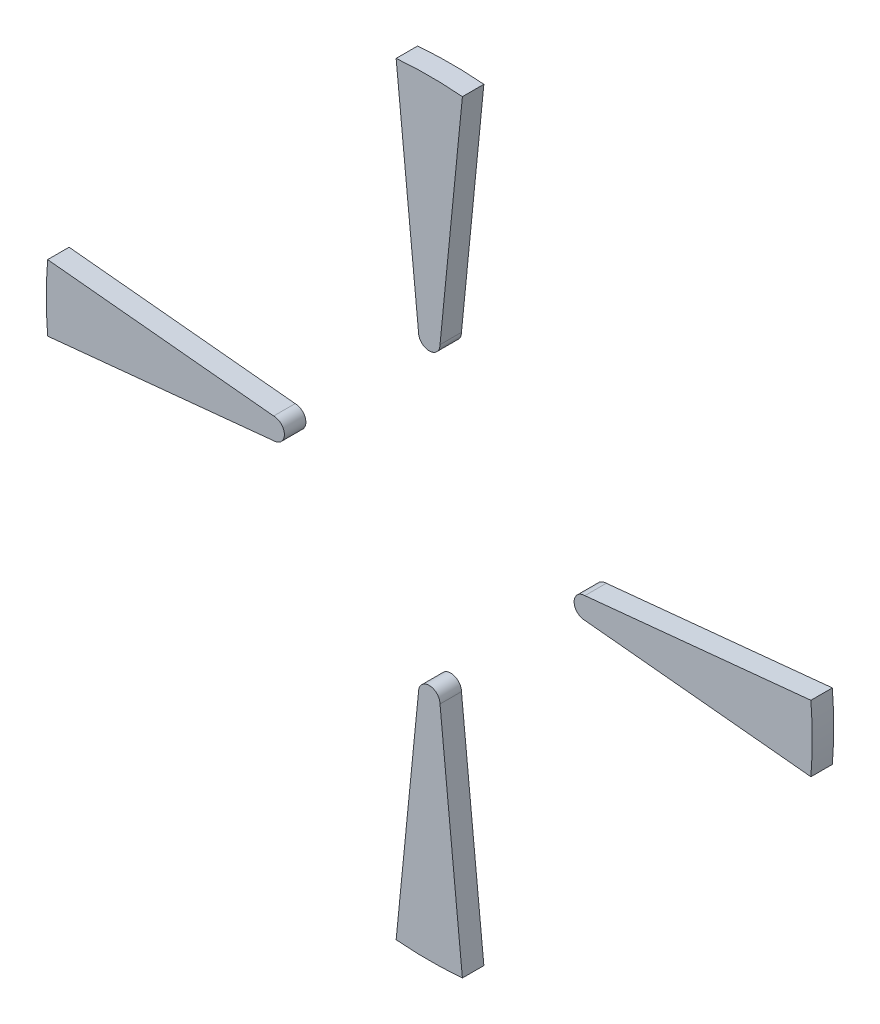
from build123d import *

# Parameters (mm, degrees)
EXTRUDE_1_DEPTH = 0.06


with BuildPart() as part:
    # 草圖1 → 填料-伸長1 (new body)
    with BuildSketch(Plane.XY):
        with BuildLine():
            ThreePointArc((-0.03, 0.435), (-0.021213203, 0.413786797), (0, 0.405))
            Line((0, 0.405), (0, 1.071017839))
            ThreePointArc((0, 1.071017839), (-0.046361859, 1.07001392), (-0.092636803, 1.067004046))
            Line((-0.092636803, 1.067004046), (-0.03, 0.435))
        make_face()
        with BuildLine():
            Line((0, 1.071017839), (0, 0.405))
            ThreePointArc((0, 0.405), (0.021213203, 0.413786797), (0.03, 0.435))
            Line((0.03, 0.435), (0.092636803, 1.067004046))
            ThreePointArc((0.092636803, 1.067004046), (0.046361859, 1.07001392), (0, 1.071017839))
        make_face()
        with BuildLine():
            ThreePointArc((-0.435, -0.03), (-0.405, 0), (-0.435, 0.03))
            Line((-0.435, 0.03), (-1.067004046, 0.092636803))
            ThreePointArc((-1.067004046, 0.092636803), (-1.071017839, 0), (-1.067004046, -0.092636803))
            Line((-1.067004046, -0.092636803), (-0.435, -0.03))
        make_face()
        with BuildLine():
            Line((0.03, -0.435), (0.092636803, -1.067004046))
            ThreePointArc((0.092636803, -1.067004046), (0, -1.071017839), (-0.092636803, -1.067004046))
            Line((-0.092636803, -1.067004046), (-0.03, -0.435))
            ThreePointArc((-0.03, -0.435), (0, -0.405), (0.03, -0.435))
        make_face()
        with BuildLine():
            Line((0.435, 0.03), (1.067004046, 0.092636803))
            ThreePointArc((1.067004046, 0.092636803), (1.071017839, 0), (1.067004046, -0.092636803))
            Line((1.067004046, -0.092636803), (0.435, -0.03))
            ThreePointArc((0.435, -0.03), (0.405, 0), (0.435, 0.03))
        make_face()
    extrude(amount=EXTRUDE_1_DEPTH)


solid = part.part
